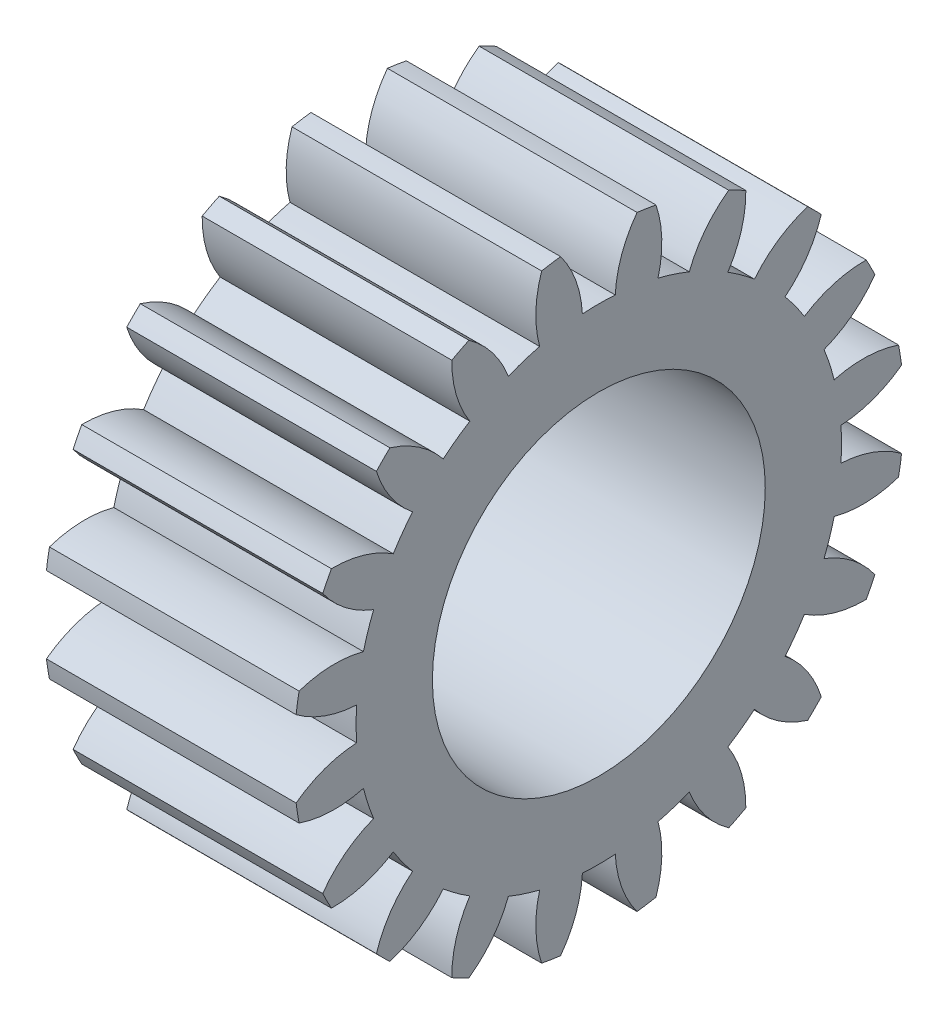
from build123d import *

# Parameters (mm, degrees)
BASPROSKE_W     = 19.05
BASPROSKE_H     = 23.283333333
TOOTHCUT_DEPTH  = 39.041158266
TEETHCUTS_COUNT = 20
TEETHCUTS_ANGLE = 342
BORSKE_R        = 12.7
BORE_DEPTH      = 50.8000508


with BuildPart() as part:
    # BasProSke → Base-Revolve (revolve)
    with BuildSketch(Plane(origin=(0, 0, 0), x_dir=(1, 0, 0), z_dir=(0, 1, 0)), mode=Mode.PRIVATE) as base_revolve_sk:
        with Locations((9.525, 11.641666667)):
            Rectangle(BASPROSKE_W, BASPROSKE_H)
    revolve(base_revolve_sk.sketch.rotate(Axis((-10, 0, 0), (1, 0, 0)), 180), axis=Axis((-10, 0, 0), (1, 0, 0)))

    # TooCutSke → ToothCut (cut, through all)
    with BuildSketch(Plane(origin=(0, 0, 0), x_dir=(0, 0, -1), z_dir=(1, 0, 0))):
        with BuildLine():
            ThreePointArc((1.255028966, 18.476989158), (0, 18.519563333), (-1.255028966, 18.476989158))
            ThreePointArc((-1.255028966, 18.476989158), (-1.748834535, 20.92537432), (-2.935531818, 23.123142143))
            ThreePointArc((-2.935531818, 23.123142143), (0, 23.308733333), (2.935531818, 23.123142143))
            ThreePointArc((2.935531818, 23.123142143), (1.748834535, 20.92537432), (1.255028966, 18.476989158))
        make_face()
    toothcut = extrude(amount=TOOTHCUT_DEPTH, mode=Mode.SUBTRACT)

    # TeethCuts: ToothCut ×20 about axis
    teethcuts_axis = Axis((-10, 0, 0), (1, 0, 0))
    for i in range(1, TEETHCUTS_COUNT):
        add(toothcut.rotate(teethcuts_axis, i * TEETHCUTS_ANGLE / (TEETHCUTS_COUNT - 1)), mode=Mode.SUBTRACT)

    # BorSke → Bore (cut, symmetric)
    with BuildSketch(Plane(origin=(0, 0, 0), x_dir=(0, 0, -1), z_dir=(1, 0, 0))):
        with Locations(Location((0, 0, 0), (0, 0, 180))):
            Circle(BORSKE_R)
    extrude(amount=BORE_DEPTH, both=True, mode=Mode.SUBTRACT)


solid = part.part
